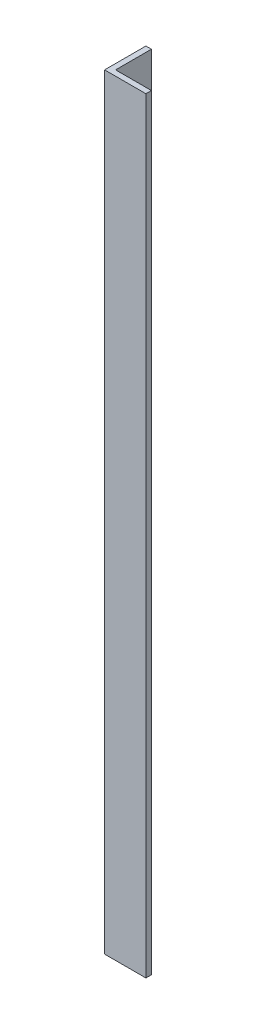
from build123d import *

# Parameters (mm, degrees)
AUFSATZ_LINEAR_AUSTRAGEN1_DEPTH = 278


with BuildPart() as part:
    # Skizze1 → Aufsatz-Linear austragen1 (new body)
    with BuildSketch(Plane(origin=(0, 0, 0), x_dir=(1, 0, 0), z_dir=(0, 1, 0))):
        Polygon((0, 0), (15, 0), (15, 2), (2, 2), (2, 15), (0, 15), align=None)
    extrude(amount=AUFSATZ_LINEAR_AUSTRAGEN1_DEPTH)


solid = part.part
